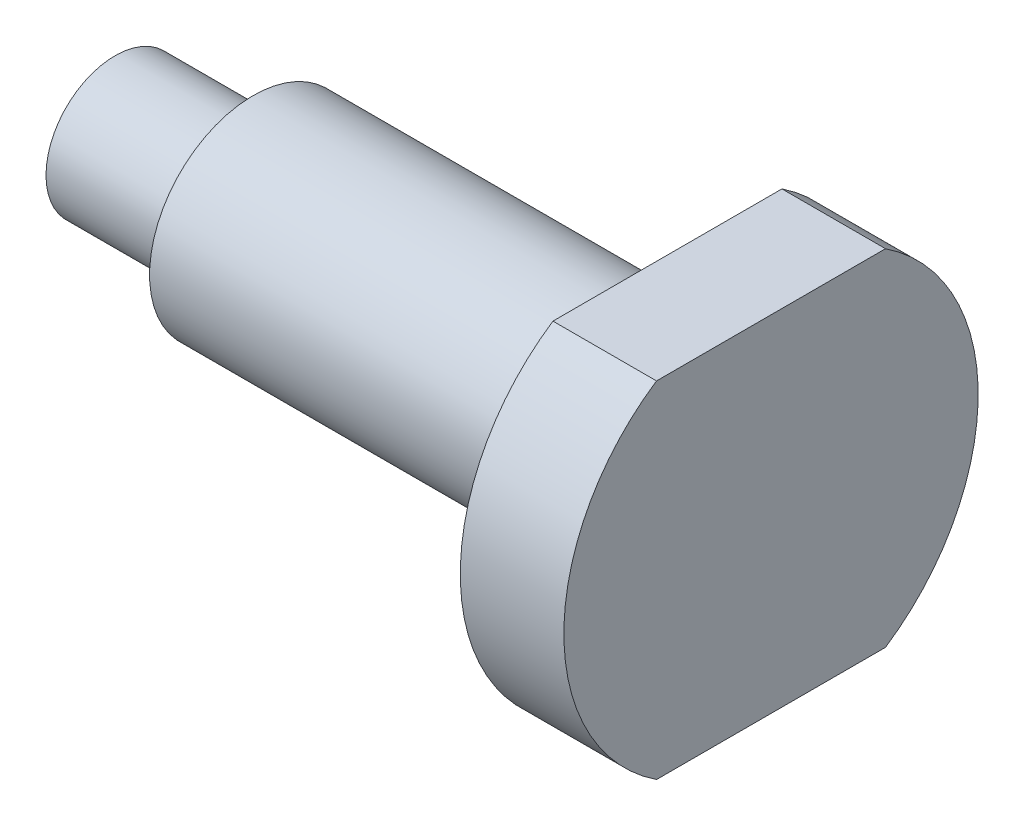
from build123d import *

# Parameters (mm, degrees)
BOSS_EXTRUDE1_DEPTH = 3
SKETCH2_3_R         = 3
BOSS_EXTRUDE2_DEPTH = 12
SKETCH3_R           = 2
BOSS_EXTRUDE3_DEPTH = 4


with BuildPart() as part:
    # Sketch2 → Boss-Extrude1 (new body)
    with BuildSketch(Plane(origin=(0, 0, 0), x_dir=(0, 0, -1), z_dir=(1, 0, 0))):
        with BuildLine():
            ThreePointArc((3.31662479, -5), (6, 0), (3.31662479, 5))
            Line((3.31662479, 5), (-3.31662479, 5))
            ThreePointArc((-3.31662479, 5), (-6, 0), (-3.31662479, -5))
            Line((-3.31662479, -5), (3.31662479, -5))
        make_face()
    extrude(amount=BOSS_EXTRUDE1_DEPTH)

    # Sketch2<3> → Boss-Extrude2 (add)
    with BuildSketch(Plane(origin=(0, 0, 0), x_dir=(0, 0, -1), z_dir=(1, 0, 0))):
        Circle(SKETCH2_3_R)
    extrude(amount=-BOSS_EXTRUDE2_DEPTH)

    # Sketch3 → Boss-Extrude3 (add)
    with BuildSketch(Plane.ZY.offset(12)):
        Circle(SKETCH3_R)
    extrude(amount=BOSS_EXTRUDE3_DEPTH)


solid = part.part
